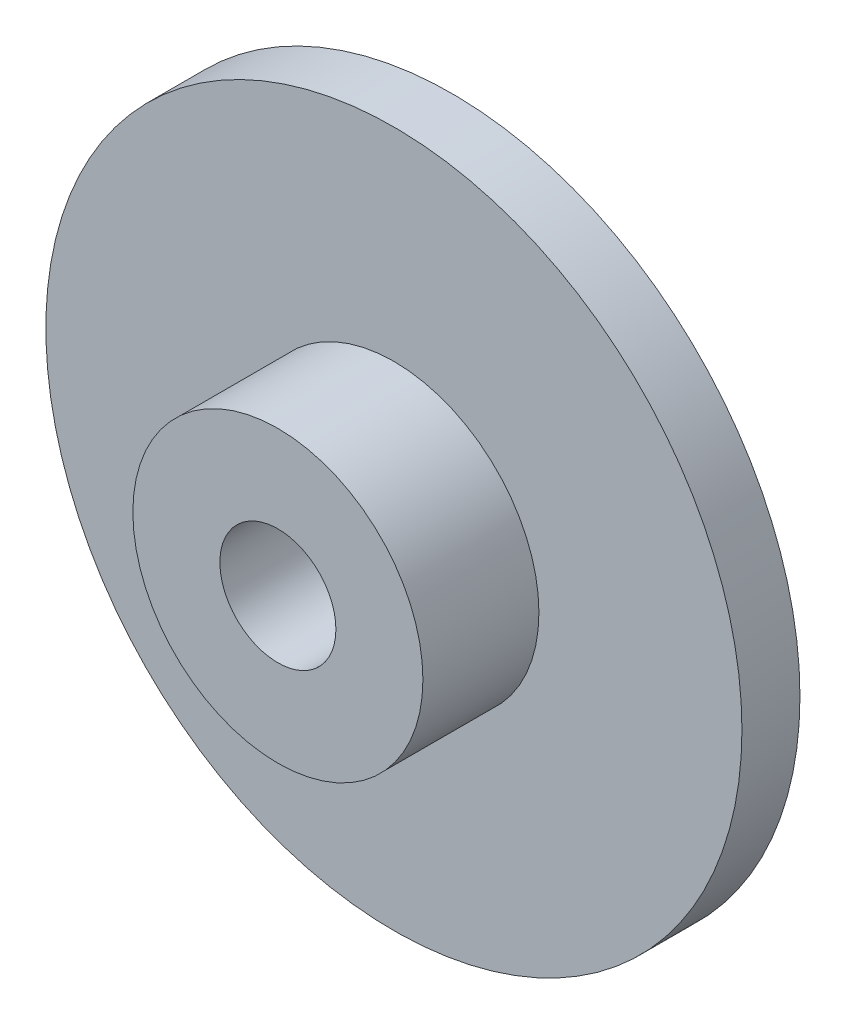
from build123d import *

# Parameters (mm, degrees)
SKETCH1_R           = 19.05
BOSS_EXTRUDE1_DEPTH = 3.175
SKETCH2_R           = 7.9375
BOSS_EXTRUDE2_DEPTH = 6.35
SKETCH3_R           = 3.175
CUT_EXTRUDE1_DEPTH  = 29.575


with BuildPart() as part:
    # Sketch1 → Boss-Extrude1 (new body)
    with BuildSketch(Plane.XY):
        Circle(SKETCH1_R)
    extrude(amount=BOSS_EXTRUDE1_DEPTH)

    # Sketch2 → Boss-Extrude2 (add)
    with BuildSketch(Plane.XY.offset(3.175)):
        Circle(SKETCH2_R)
    extrude(amount=BOSS_EXTRUDE2_DEPTH)

    # Sketch3 → Cut-Extrude1 (cut, through all)
    with BuildSketch(Plane.XY.offset(9.525)):
        Circle(SKETCH3_R)
    extrude(amount=-CUT_EXTRUDE1_DEPTH, mode=Mode.SUBTRACT)


solid = part.part
